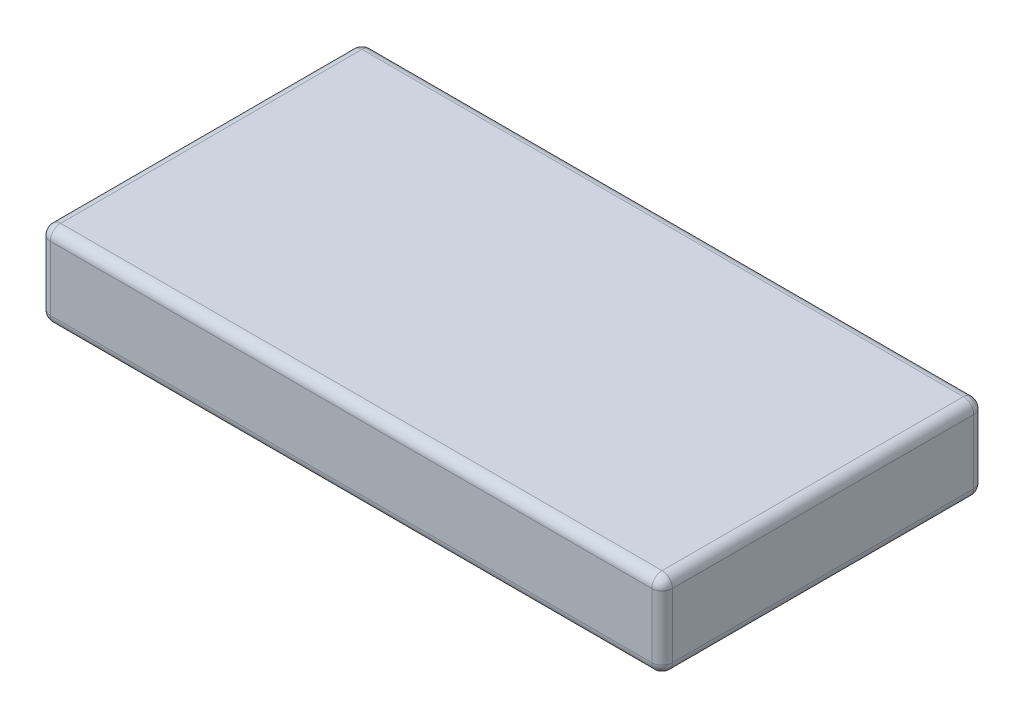
from build123d import *

# Parameters (mm, degrees)
SKETCH_1_W      = 60.1
SKETCH_1_H      = 8.2
EXTRUDE_1_DEPTH = 15.55
FILLET_1_R      = 1


with BuildPart() as part:
    # 草图1 → 凸台-拉伸1 (new, symmetric)
    with BuildSketch(Plane.XY):
        Rectangle(SKETCH_1_W, SKETCH_1_H)
    extrude(amount=EXTRUDE_1_DEPTH, both=True)

    # 圆角1
    fillet_1_edges = [part.edges().sort_by_distance(p)[0] for p in [
        (-30.05, 0, 15.55),
        (0, -4.1, 15.55),
        (30.05, 0, 15.55),
        (0, -4.1, -15.55),
        (-30.05, 0, -15.55),
        (0, 4.1, -15.55),
        (30.05, 0, -15.55),
        (30.05, -4.1, 0),
        (-30.05, -4.1, 0),
        (-30.05, 4.1, 0),
        (30.05, 4.1, 0),
        (0, 4.1, 15.55),
    ]]
    fillet(fillet_1_edges, radius=FILLET_1_R)


solid = part.part
